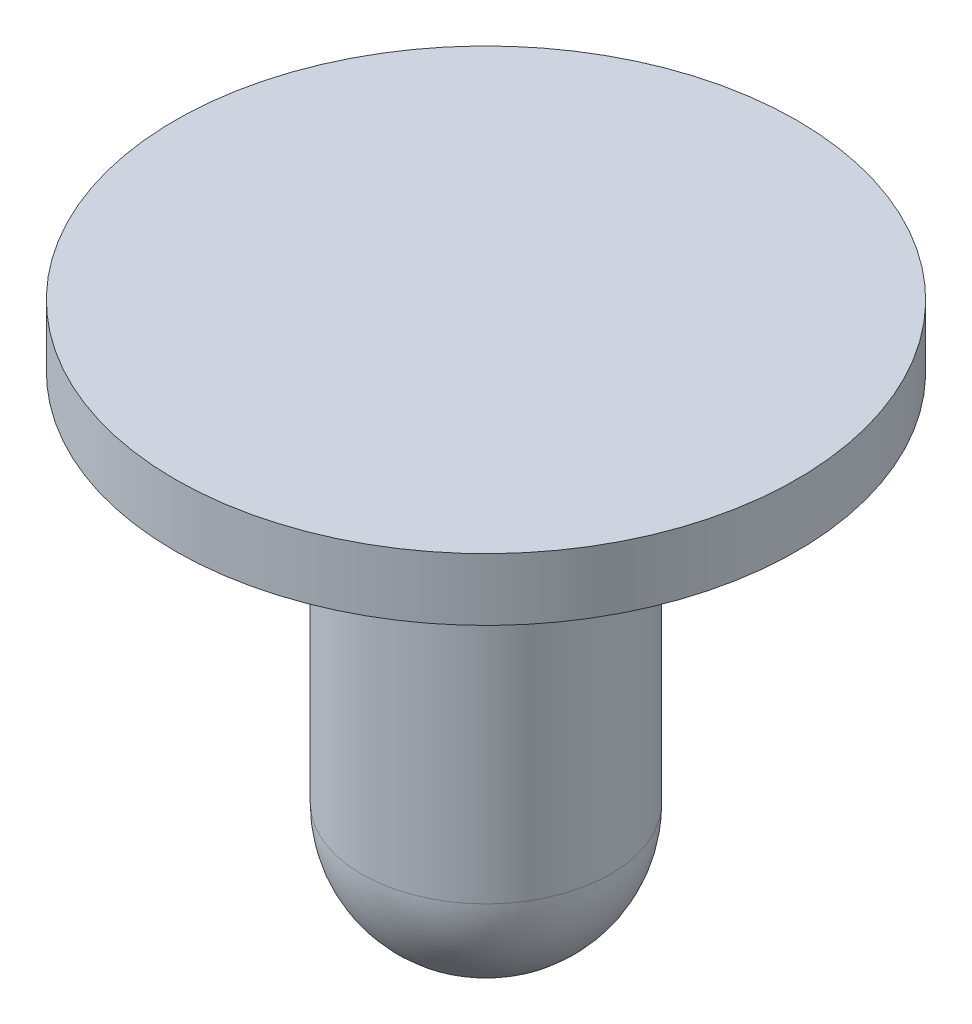
from build123d import *

# Parameters (mm, degrees)
SKETCH1_R           = 12.7
BOSS_EXTRUDE1_DEPTH = 2.54
SKETCH3_R           = 5.08
BOSS_EXTRUDE2_DEPTH = 15.24


with BuildPart() as part:
    # Sketch1 → Boss-Extrude1 (new body)
    with BuildSketch(Plane(origin=(0, 0, 0), x_dir=(1, 0, 0), z_dir=(0, 1, 0))):
        with Locations(Location((0, 0, 0), (0, 0, 270))):
            Circle(SKETCH1_R)
    extrude(amount=BOSS_EXTRUDE1_DEPTH)

    # Sketch3 → Boss-Extrude2 (add)
    with BuildSketch(Plane.XZ):
        with Locations(Location((0, 0, 0), (0, 0, 90))):
            Circle(SKETCH3_R)
    extrude(amount=BOSS_EXTRUDE2_DEPTH)

    # Sketch5 → Revolve2 (revolve)
    with BuildSketch(Plane(origin=(0, 0, 0), x_dir=(0, 0, -1), z_dir=(1, 0, 0))):
        with BuildLine():
            Line((0, -15.24), (0, -20.32))
            ThreePointArc((0, -20.32), (-3.592102448, -18.832102448), (-5.08, -15.24))
            Line((-5.08, -15.24), (0, -15.24))
        make_face()
    revolve(axis=Axis((0, -15.24, 0), (0, -1, 0)))


solid = part.part
